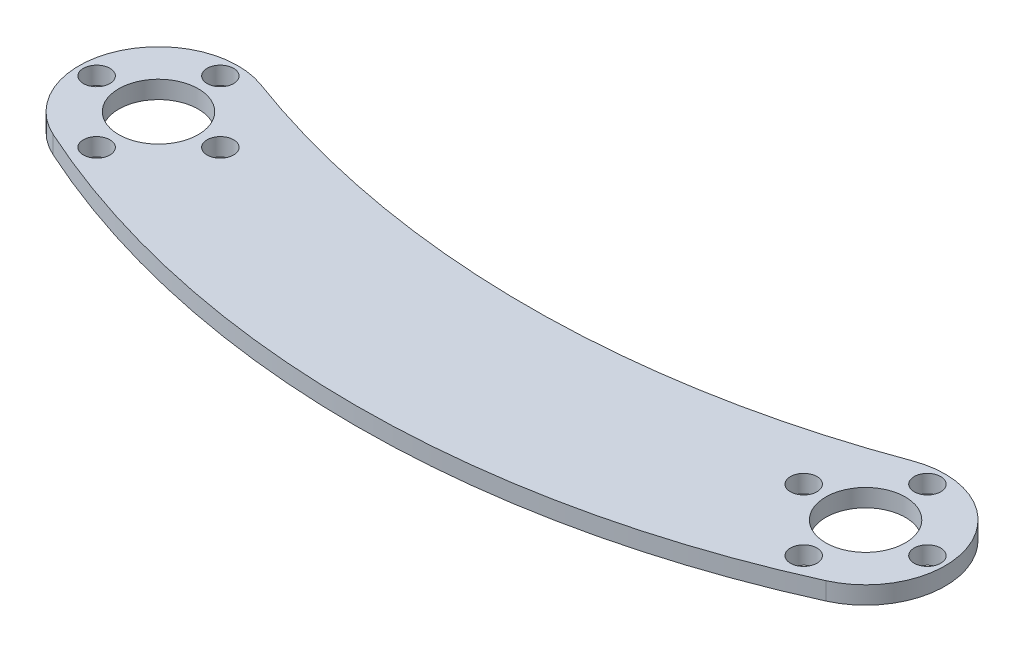
from build123d import *

# Parameters (mm, degrees)
EXTRUDE_1_DEPTH     = 2
SKETCH_2_R          = 4.5
SKETCH_2_R_2        = 1.5
CUT_EXTRUDE_1_DEPTH = 91.751684032


with BuildPart() as part:
    # 草图1 → 凸台-拉伸1 (new body)
    with BuildSketch(Plane(origin=(0, 0, 0), x_dir=(1, 0, 0), z_dir=(0, 1, 0))):
        with BuildLine():
            ThreePointArc((3.130434783, 8.438031647), (40, 1.819293264), (76.869565217, 8.438031647))
            ThreePointArc((76.869565217, 8.438031647), (88.32365676, 3.422972121), (83.711340206, -8.199143484))
            ThreePointArc((83.711340206, -8.199143484), (40, -17.63145356), (-3.711340206, -8.199143484))
            ThreePointArc((-3.711340206, -8.199143484), (-8.32365676, 3.422972121), (3.130434783, 8.438031647))
        make_face()
    extrude(amount=EXTRUDE_1_DEPTH)

    # 草图2 → 切除-拉伸1 (cut, through all)
    with BuildSketch(Plane(origin=(0, 2, 0), x_dir=(1, 0, 0), z_dir=(0, 1, 0))):
        with Locations(Location((0, 0, 0), (0, 0, 270))):
            Circle(SKETCH_2_R)
        with Locations(Location((80, 0, 0), (0, 0, 270))):
            Circle(SKETCH_2_R)
        with Locations(Location((7, 0, 0), (0, 0, 270))):
            Circle(SKETCH_2_R_2)
        with Locations(Location((0, -7, 0), (0, 0, 270))):
            Circle(SKETCH_2_R_2)
        with Locations(Location((-7, 0, 0), (0, 0, 270))):
            Circle(SKETCH_2_R_2)
        with Locations(Location((0, 7, 0), (0, 0, 270))):
            Circle(SKETCH_2_R_2)
        with Locations(Location((73, 0, 0), (0, 0, 270))):
            Circle(SKETCH_2_R_2)
        with Locations(Location((80, 7, 0), (0, 0, 270))):
            Circle(SKETCH_2_R_2)
        with Locations(Location((87, 0, 0), (0, 0, 270))):
            Circle(SKETCH_2_R_2)
        with Locations(Location((80, -7, 0), (0, 0, 270))):
            Circle(SKETCH_2_R_2)
    extrude(amount=-CUT_EXTRUDE_1_DEPTH, mode=Mode.SUBTRACT)


solid = part.part
